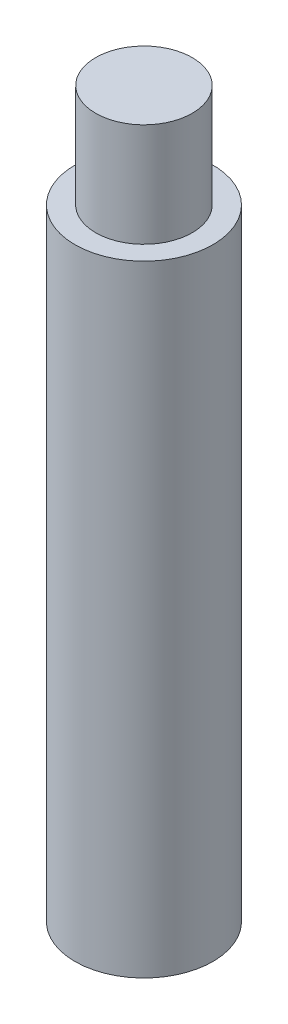
from build123d import *

# Parameters (mm, degrees)
SKETCH_1_R             = 2
EXTRUDE_1_DEPTH        = 18
SKETCH_2_R             = 1.4
EXTRUDE_2_DEPTH        = 3
HOLE_WIZARD_M3_1_D     = 2.5
HOLE_WIZARD_M3_1_DEPTH = 7.5
HOLE_WIZARD_M3_1_TIP   = 0.751075774


with BuildPart() as part:
    # 草图1 → 凸台-拉伸1 (new body)
    with BuildSketch(Plane(origin=(0, 0, 0), x_dir=(1, 0, 0), z_dir=(0, 1, 0))):
        with Locations(Location((0, 0, 0), (0, 0, 270))):
            Circle(SKETCH_1_R)
    extrude(amount=-EXTRUDE_1_DEPTH)

    # 草图2 → 凸台-拉伸2 (add)
    with BuildSketch(Plane(origin=(0, 0, 0), x_dir=(1, 0, 0), z_dir=(0, 1, 0))):
        with Locations(Location((0, 0, 0), (0, 0, 270))):
            Circle(SKETCH_2_R)
    extrude(amount=EXTRUDE_2_DEPTH)

    # M3 螺纹孔1
    with Locations(Plane(origin=(0, -18, 0), x_dir=(0, 0, -1), z_dir=(0, -1, 0))):
        with Locations((0, 0)):
            Hole(HOLE_WIZARD_M3_1_D / 2, depth=HOLE_WIZARD_M3_1_DEPTH)
            with Locations((0, 0, -(HOLE_WIZARD_M3_1_DEPTH + HOLE_WIZARD_M3_1_TIP / 2))):  # 118° drill point
                Cone(0, HOLE_WIZARD_M3_1_D / 2, HOLE_WIZARD_M3_1_TIP, mode=Mode.SUBTRACT)


solid = part.part
